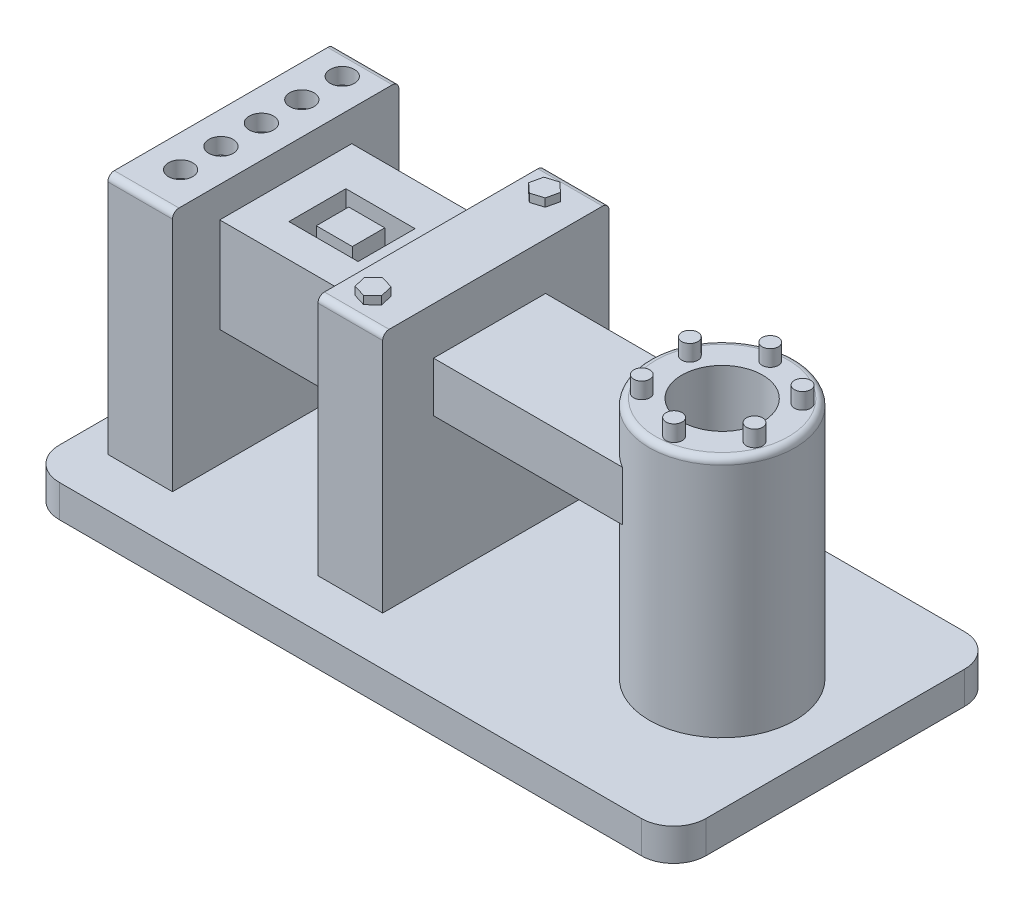
from build123d import *

# Parameters (mm, degrees)
ESBO_O2_W                     = 400
ESBO_O2_H                     = 200
RESSALTO_EXTRUS_O1_DEPTH      = 20
FILETE4_R                     = 20
ESBO_O4_R                     = 45
ESBO_O4_W                     = 40
ESBO_O4_H                     = 140
RESSALTO_EXTRUS_O4_DEPTH      = 150
ESBO_O5_W                     = 81.658803593
ESBO_O5_H                     = 58.716236851
RESSALTO_EXTRUS_O5_DEPTH      = 90
RESSALTO_EXTRUS_O6_REACH      = 290.097
RESSALTO_EXTRUS_O6_END_RADIUS = 45
ESBO_O6_W                     = 69.29625837
ESBO_O6_H                     = 30.851919202
ESBO_O8_R                     = 5
RESSALTO_EXTRUS_O8_DEPTH      = 10
PADR_OCIRCULAR2_COUNT         = 6
FILETE6_R                     = 4
RESSALTO_EXTRUS_O9_DEPTH      = 5
ESBO_O12_R                    = 25
CORTE_EXTRUS_O1_DEPTH         = 90
ESBO_O13_W                    = 42.800869612
ESBO_O13_H                    = 35.221548951
ESBO_O13_W_2                  = 22.29211959
ESBO_O13_H_2                  = 20.06290763
CORTE_EXTRUS_O2_DEPTH         = 41
ESBO_O7_R                     = 7.5
CORTE_EXTRUS_O3_DEPTH         = 10
PADR_O_LINEAR1_COUNT          = 5
PADR_O_LINEAR1_PITCH          = 25


with BuildPart() as part:
    # Esboço2 → Ressalto-extrusão1 (new body)
    with BuildSketch(Plane(origin=(0, 0, 0), x_dir=(1, 0, 0), z_dir=(0, 1, 0))):
        Rectangle(ESBO_O2_W, ESBO_O2_H)
    extrude(amount=RESSALTO_EXTRUS_O1_DEPTH)

    # Filete4
    filete4_edges = [part.edges().sort_by_distance(p)[0] for p in [
        (200, 10, 100),
        (200, 10, -100),
        (-200, 10, -100),
        (-200, 10, 100),
    ]]
    fillet(filete4_edges, radius=FILETE4_R)

    # Esboço4 → Ressalto-extrusão4 (add)
    with BuildSketch(Plane(origin=(0, 20, 0), x_dir=(1, 0, 0), z_dir=(0, 1, 0))):
        with Locations(Location((130, 0, 0), (0, 0, 270))):
            Circle(ESBO_O4_R)
        with Locations((-160, 0)):
            Rectangle(ESBO_O4_W, ESBO_O4_H)
        with Locations((-30, 0)):
            Rectangle(ESBO_O4_W, ESBO_O4_H)
    extrude(amount=RESSALTO_EXTRUS_O4_DEPTH)

    # Ressalto-extrusão6: up to this cylinder (the profile starts outside it)
    ressalto_extrus_o6_end = Plane(origin=(130, 125.393831, 0), z_dir=(0, -1, 0)) * Cylinder(RESSALTO_EXTRUS_O6_END_RADIUS, 671.194, mode=Mode.PRIVATE)
    # Esboço6 → Ressalto-extrusão6 (add, up to the surface)
    with BuildSketch(Plane(origin=(-10, 0, 0), x_dir=(0, 0, -1), z_dir=(1, 0, 0)), mode=Mode.PRIVATE) as ressalto_extrus_o6_sk1:
        with Locations((-3.877016652, 125.393831311)):
            Rectangle(ESBO_O6_W, ESBO_O6_H)
    ressalto_extrus_o6_tool1 = extrude(ressalto_extrus_o6_sk1.sketch, amount=RESSALTO_EXTRUS_O6_REACH, mode=Mode.PRIVATE) - ressalto_extrus_o6_end
    add(ressalto_extrus_o6_tool1.solids().sort_by_distance((-10, 125.393831, 3.877017))[0])

    # Esboço8 → Ressalto-extrusão8 (add)
    with BuildSketch(Plane(origin=(0, 170, 0), x_dir=(1, 0, 0), z_dir=(0, 1, 0))):
        with Locations(Location((124.732936709, 35, 0), (0, 0, 270))):
            Circle(ESBO_O8_R)
    ressalto_extrus_o8 = extrude(amount=RESSALTO_EXTRUS_O8_DEPTH)

    # PadrãoCircular2: Ressalto-extrusão8 ×6 about axis
    padr_ocircular2_axis = Axis((130, 0, 0), (0, 1, 0))
    for i in range(1, PADR_OCIRCULAR2_COUNT):
        add(ressalto_extrus_o8.rotate(padr_ocircular2_axis, i * 360 / PADR_OCIRCULAR2_COUNT))

    # Filete6
    filete6_edges = [part.edges().sort_by_distance(p)[0] for p in [
        (-160, 170, 70),
        (-160, 170, -70),
        (-30, 170, 70),
        (-30, 170, -70),
        (130, 170, -45),
    ]]
    fillet(filete6_edges, radius=FILETE6_R)

    # Esboço9 → Ressalto-extrusão9 (add)
    with BuildSketch(Plane(origin=(0, 170, 0), x_dir=(1, 0, 0), z_dir=(0, 1, 0))):
        Polygon((-27.108026111, 47.663480137), (-25.359402405, 55.344402951), (-31.136964834, 60.69921691), (-38.663150969, 58.373108054), (-40.411774675, 50.692185239), (-34.634212246, 45.33737128), align=None)
    ressalto_extrus_o9 = extrude(amount=RESSALTO_EXTRUS_O9_DEPTH)

    # Espelhar1: Ressalto-extrusão9 across plane
    add(ressalto_extrus_o9.mirror(Plane(origin=(0, 0, 0), x_dir=(1, 0, 0), z_dir=(0, 0, -1))))

    # Esboço12 → Corte-extrusão1 (cut)
    with BuildSketch(Plane(origin=(0, 170, 0), x_dir=(1, 0, 0), z_dir=(0, 1, 0))):
        with Locations(Location((130, 0, 0), (0, 0, 270))):
            Circle(ESBO_O12_R)
    extrude(amount=-CORTE_EXTRUS_O1_DEPTH, mode=Mode.SUBTRACT)

    # Esboço7 → Corte-extrusão3 (cut)
    with BuildSketch(Plane(origin=(0, 170, 0), x_dir=(1, 0, 0), z_dir=(0, 1, 0))):
        with Locations(Location((-160, 55, 0), (0, 0, 270))):
            Circle(ESBO_O7_R)
    corte_extrus_o3 = extrude(amount=-CORTE_EXTRUS_O3_DEPTH, mode=Mode.SUBTRACT)

    # Padrão linear1: Corte-extrusão3 ×5
    with Locations(*[(0, 0, i * PADR_O_LINEAR1_PITCH) for i in range(1, PADR_O_LINEAR1_COUNT)]):
        add(corte_extrus_o3, mode=Mode.SUBTRACT)


with BuildPart() as body_2:
    # Esboço5 → Ressalto-extrusão5 (new body)
    with BuildSketch(Plane(origin=(-140, 0, 0), x_dir=(0, 0, -1), z_dir=(1, 0, 0))):
        with Locations((0.066363841, 121.641358838)):
            Rectangle(ESBO_O5_W, ESBO_O5_H)
    extrude(amount=RESSALTO_EXTRUS_O5_DEPTH)

    # Esboço13 → Corte-extrusão2 (cut)
    with BuildSketch(Plane(origin=(0, 150.999477263, 0), x_dir=(1, 0, 0), z_dir=(0, 1, 0))):
        with Locations((-96.301956627, -2.675054351)):
            Rectangle(ESBO_O13_W, ESBO_O13_H)
        with Locations((-95.856114235, -4.012581526)):
            Rectangle(ESBO_O13_W_2, ESBO_O13_H_2, mode=Mode.SUBTRACT)
    extrude(amount=-CORTE_EXTRUS_O2_DEPTH, mode=Mode.SUBTRACT)


solid = Compound([part.part, body_2.part])
